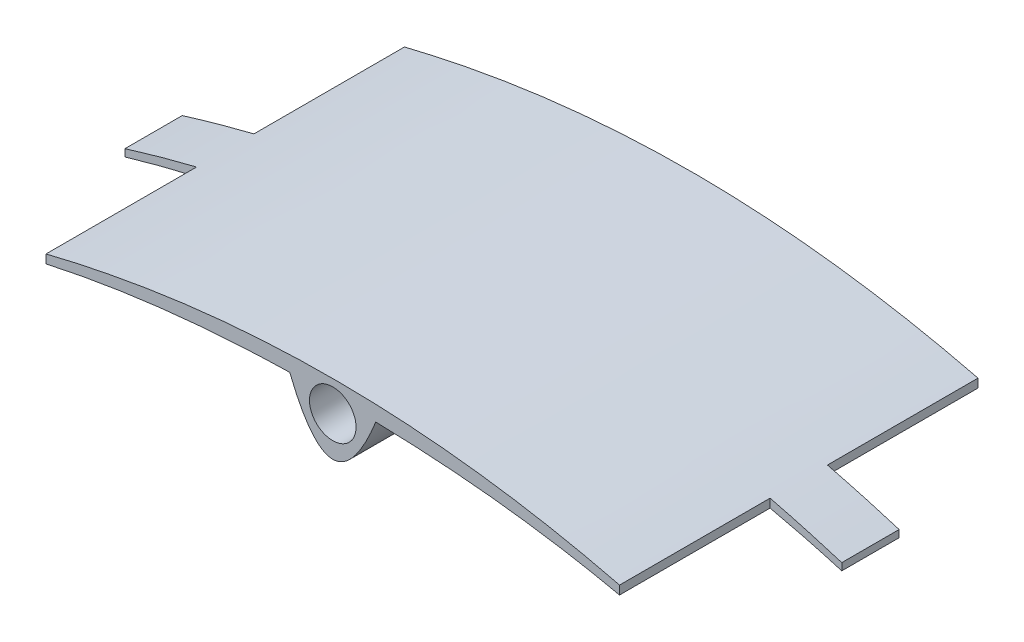
from build123d import *

# Parameters (mm, degrees)
SKETCH_1_R               = 3.25
EXTRUDE_1_DEPTH          = 50
CUT_EXTRUDE_1_DEPTH      = 71.92425552
CUT_EXTRUDE_1_DEPTH_BACK = 71.92425552
SKETCH_2_W               = 10
SKETCH_2_H               = 21


with BuildPart() as part:
    # 草圖1 → 填料-伸長1 (new body)
    with BuildSketch(Plane.XY):
        with BuildLine():
            Line((-50, -3.480646824), (-50, -4.480646824))
            add(Edge.make_bspline(
                [(-6, 2), (-30, 1.47316016), (-50, -4.480646824)],
                knots=[0, 0, 0, 1, 1, 1], degree=2))
            add(Edge.make_bspline(
                [(-6, 2), (0, -13), (6, 2)],
                knots=[0, 0, 0, 1, 1, 1], degree=2))
            add(Edge.make_bspline(
                [(6, 2), (30, 1.47316016), (50, -4.480646824)],
                knots=[0, 0, 0, 1, 1, 1], degree=2))
            Line((50, -4.480646824), (50, -3.480646824))
            add(Edge.make_bspline(
                [(-50, -3.480646824), (0, 12), (50, -3.480646824)],
                knots=[0, 0, 0, 1, 1, 1], degree=2))
        make_face()
        Circle(SKETCH_1_R, mode=Mode.SUBTRACT)
    extrude(amount=EXTRUDE_1_DEPTH)

    # 草圖2 → 除料-伸長1 (cut, two sides: drawn at the far end of the back side and taken through both)
    with BuildSketch(Plane(origin=(0, 0, 0), x_dir=(1, 0, 0), z_dir=(0, 1, 0)).offset(-CUT_EXTRUDE_1_DEPTH_BACK)):
        with Locations((-45, -39.5)):
            Rectangle(SKETCH_2_W, SKETCH_2_H)
        with Locations((-45, -10.5)):
            Rectangle(SKETCH_2_W, SKETCH_2_H)
        with Locations((45, -10.5)):
            Rectangle(SKETCH_2_W, SKETCH_2_H)
        with Locations((45, -39.5)):
            Rectangle(SKETCH_2_W, SKETCH_2_H)
    extrude(amount=CUT_EXTRUDE_1_DEPTH + CUT_EXTRUDE_1_DEPTH_BACK, mode=Mode.SUBTRACT)


solid = part.part
